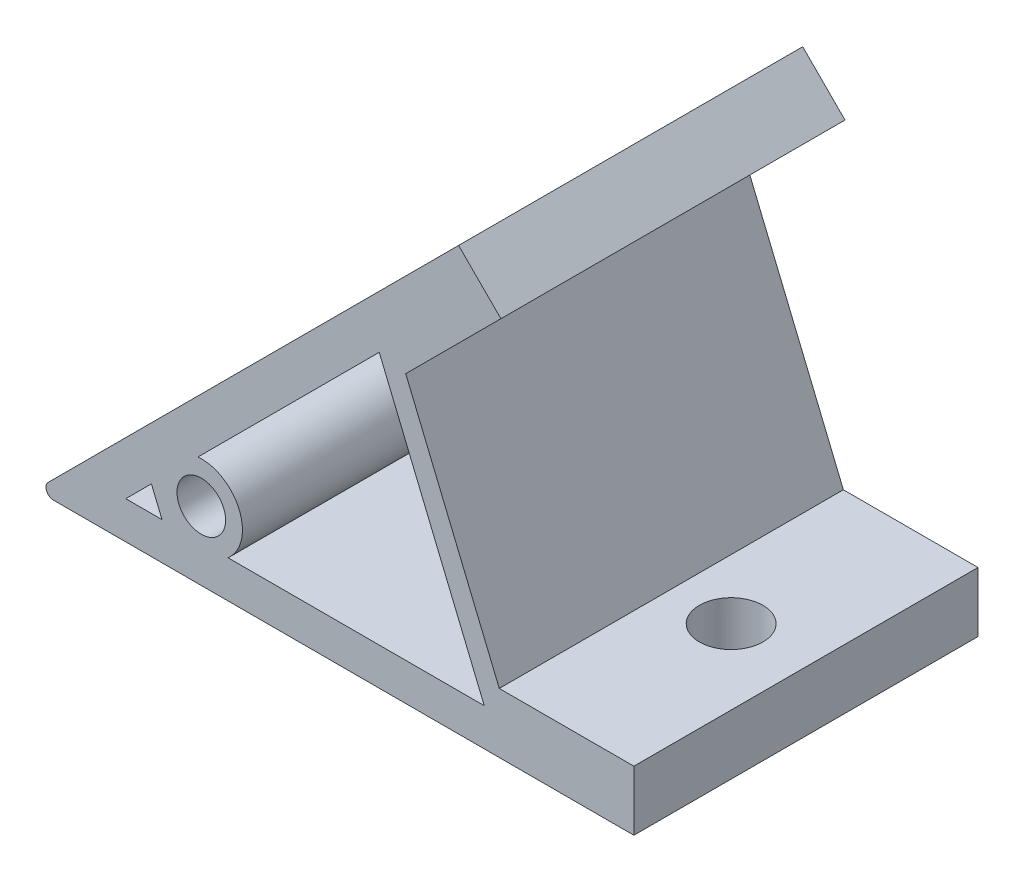
from build123d import *

# Parameters (mm, degrees)
SKETCH_1_R          = 3.25
EXTRUDE_1_DEPTH     = 23
SKETCH_3_R          = 4.25
CUT_EXTRUDE_1_DEPTH = 17


with BuildPart() as part:
    # 草图1 → 凸台-拉伸1 (new, symmetric)
    with BuildSketch(Plane.XY):
        with BuildLine():
            Line((-77.585786438, 0), (0, 0))
            Line((0, 0), (0, 8))
            Line((0, 8), (-17.995464086, 8))
            Line((-17.995464086, 8), (-30.499317942, 38.186973559))
            Line((-30.499317942, 38.186973559), (-17.774603256, 50.911688245))
            Line((-17.774603256, 50.911688245), (-23.431457505, 56.568542495))
            Line((-23.431457505, 56.568542495), (-78.292893219, 1.707106781))
            ThreePointArc((-78.292893219, 1.707106781), (-78.50966597, 0.617316568), (-77.585786438, 0))
        make_face()
        with Locations((-57.82689122, 9.184402377)):
            Circle(SKETCH_1_R, mode=Mode.SUBTRACT)
        Polygon((-67.928932188, 5), (-63.07447047, 5), (-64.496309389, 8.4326228), align=None, mode=Mode.SUBTRACT)
        with BuildLine():
            Line((-54.257468753, 5), (-20, 5))
            Line((-20, 5), (-34.038059223, 38.890872965))
            Line((-34.038059223, 38.890872965), (-58.261747684, 14.667184504))
            ThreePointArc((-58.261747684, 14.667184504), (-52.745553791, 11.289161255), (-54.257468753, 5))
        make_face(mode=Mode.SUBTRACT)
    extrude(amount=EXTRUDE_1_DEPTH, both=True)

    # 草图3 → 切除-拉伸1 (cut)
    with BuildSketch(Plane(origin=(0, 8, 0), x_dir=(1, 0, 0), z_dir=(0, 1, 0))):
        with Locations(Location((-10, 0, 0), (0, 0, 180))):
            Circle(SKETCH_3_R)
    cut_extrude_1 = extrude(amount=-CUT_EXTRUDE_1_DEPTH, mode=Mode.SUBTRACT)

    # 镜向1: 切除-拉伸1 across plane
    add(cut_extrude_1.mirror(Plane(origin=(-11.715728753, 28.284271247, 0), x_dir=(0, 0, 1), z_dir=(-0.3826834323650881, 0.9238795325112875, 0))), mode=Mode.SUBTRACT)


solid = part.part
